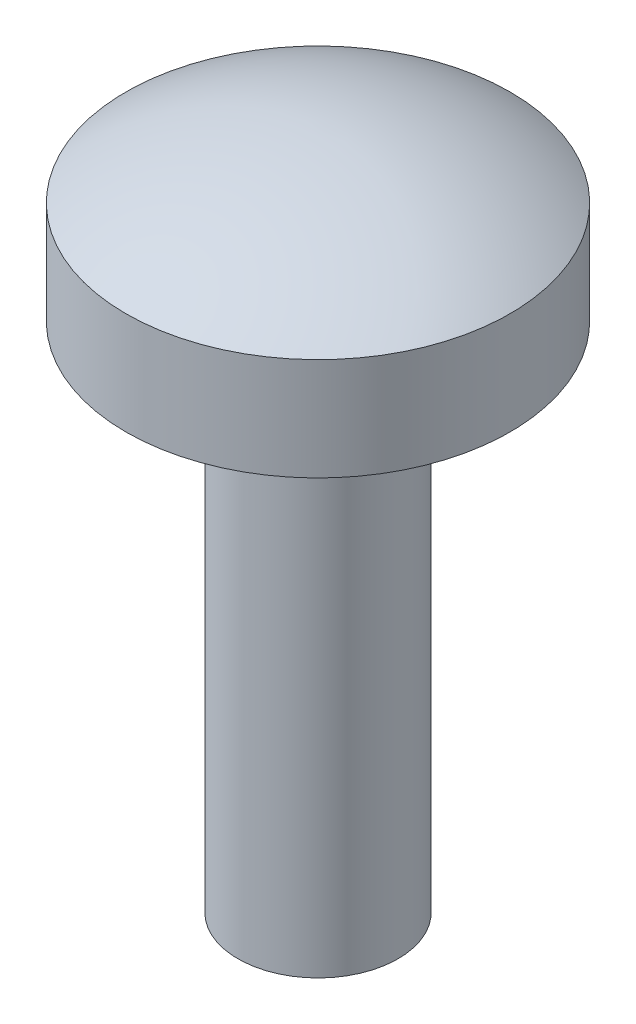
from build123d import *

# Parameters (mm, degrees)
SKETCH3_R           = 1.25
BOSS_EXTRUDE1_DEPTH = 8


with BuildPart() as part:
    # Sketch2 → Revolve1 (revolve)
    with BuildSketch(Plane(origin=(0, 0, 0), x_dir=(0, 0, -1), z_dir=(1, 0, 0)), mode=Mode.PRIVATE) as revolve1_sk:
        with BuildLine():
            Line((0, 0), (3, 0))
            Line((3, 0), (3, 1.6))
            ThreePointArc((3, 1.6), (1.568948693, 2.284832693), (0, 2.52))
            Line((0, 2.52), (0, 0))
        make_face()
    revolve(revolve1_sk.sketch.rotate(Axis((0, 2.52, 0), (0, -1, 0)), 180), axis=Axis((0, 2.52, 0), (0, -1, 0)))

    # Sketch3 → Boss-Extrude1 (add)
    with BuildSketch(Plane.XZ):
        with Locations(Location((0, 0, 0), (0, 0, 270))):
            Circle(SKETCH3_R)
    extrude(amount=BOSS_EXTRUDE1_DEPTH)


solid = part.part
